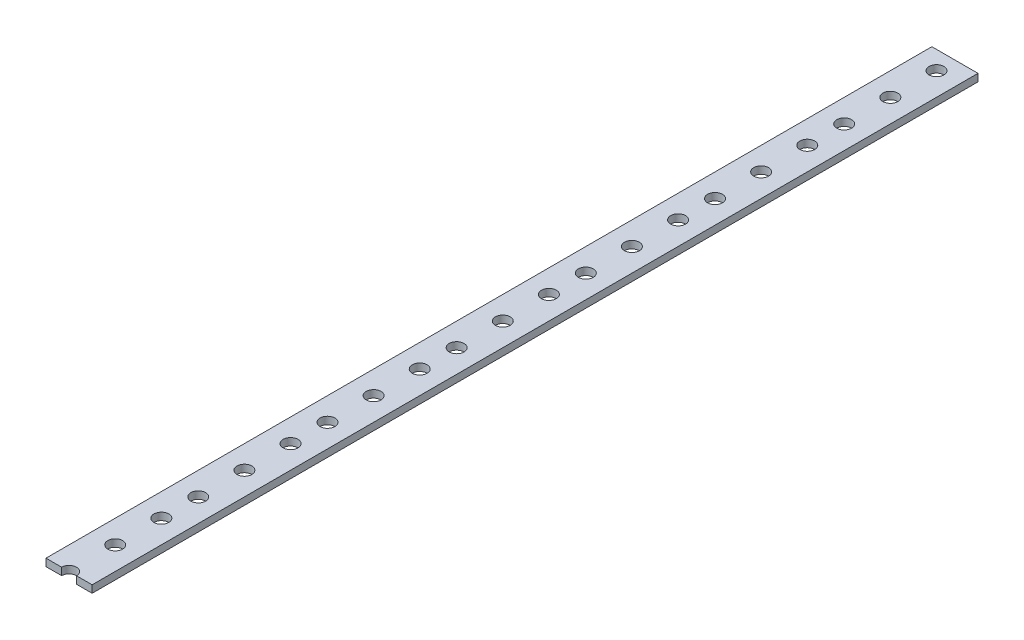
from build123d import *

# Parameters (mm, degrees)
SKETCH1_W                  = 15.875
SKETCH1_H                  = 304.8
BOSS_EXTRUDE1_DEPTH        = 2.54
SKETCH2_R                  = 2.5527
CUT_EXTRUDE1_DEPTH         = 2.54
LPATTERN1_COUNT            = 3
LPATTERN1_PITCH            = 15.875
LPATTERN2_COUNT            = 7
LPATTERN2_PITCH            = 44.45
LPATTERN2_COPY_1_SKETCH_R  = 2.5527
LPATTERN2_COPY_1_DEPTH     = 2.54
LPATTERN2_COPY_2_SKETCH_R  = 2.5527
LPATTERN2_COPY_2_DEPTH     = 2.54
LPATTERN2_COPY_3_SKETCH_R  = 2.5527
LPATTERN2_COPY_3_DEPTH     = 2.54
LPATTERN2_COPY_4_SKETCH_R  = 2.5527
LPATTERN2_COPY_4_DEPTH     = 2.54
LPATTERN2_COPY_5_SKETCH_R  = 2.5527
LPATTERN2_COPY_5_DEPTH     = 2.54
LPATTERN2_COPY_6_SKETCH_R  = 2.5527
LPATTERN2_COPY_6_DEPTH     = 2.54
LPATTERN2_COPY_7_SKETCH_R  = 2.5527
LPATTERN2_COPY_7_DEPTH     = 2.54
LPATTERN2_COPY_8_SKETCH_R  = 2.5527
LPATTERN2_COPY_8_DEPTH     = 2.54
LPATTERN2_COPY_9_SKETCH_R  = 2.5527
LPATTERN2_COPY_9_DEPTH     = 2.54
LPATTERN2_COPY_10_SKETCH_R = 2.5527
LPATTERN2_COPY_10_DEPTH    = 2.54
LPATTERN2_COPY_11_SKETCH_R = 2.5527
LPATTERN2_COPY_11_DEPTH    = 2.54
LPATTERN2_COPY_12_SKETCH_R = 2.5527
LPATTERN2_COPY_12_DEPTH    = 2.54


with BuildPart() as part:
    # Sketch1 → Boss-Extrude1 (new body)
    with BuildSketch(Plane(origin=(0, 0, 0), x_dir=(1, 0, 0), z_dir=(0, 1, 0))):
        Rectangle(SKETCH1_W, SKETCH1_H)
    extrude(amount=BOSS_EXTRUDE1_DEPTH)

    # Sketch2 → Cut-Extrude1 (cut)
    with BuildSketch(Plane(origin=(0, 2.54, 0), x_dir=(1, 0, 0), z_dir=(0, 1, 0))):
        with Locations(Location((0, 146.05, 0), (0, 0, 270))):
            Circle(SKETCH2_R)
    cut_extrude1 = extrude(amount=-CUT_EXTRUDE1_DEPTH, mode=Mode.SUBTRACT)

    # LPattern1: Cut-Extrude1 ×3
    with Locations(*[(0, 0, i * LPATTERN1_PITCH) for i in range(1, LPATTERN1_COUNT)]):
        add(cut_extrude1, mode=Mode.SUBTRACT)

    # LPattern2: Cut-Extrude1 ×7
    with Locations(*[(0, 0, i * LPATTERN2_PITCH) for i in range(1, LPATTERN2_COUNT)]):
        add(cut_extrude1, mode=Mode.SUBTRACT)

    # LPattern2 copy 1 sketch → LPattern2 copy 1 (cut)
    with BuildSketch(Plane(origin=(0, 2.54, 60.325), x_dir=(1, 0, 0), z_dir=(0, 1, 0))):
        with Locations(Location((0, 146.05, 0), (0, 0, 270))):
            Circle(LPATTERN2_COPY_1_SKETCH_R)
    extrude(amount=-LPATTERN2_COPY_1_DEPTH, mode=Mode.SUBTRACT)

    # LPattern2 copy 2 sketch → LPattern2 copy 2 (cut)
    with BuildSketch(Plane(origin=(0, 2.54, 104.775), x_dir=(1, 0, 0), z_dir=(0, 1, 0))):
        with Locations(Location((0, 146.05, 0), (0, 0, 270))):
            Circle(LPATTERN2_COPY_2_SKETCH_R)
    extrude(amount=-LPATTERN2_COPY_2_DEPTH, mode=Mode.SUBTRACT)

    # LPattern2 copy 3 sketch → LPattern2 copy 3 (cut)
    with BuildSketch(Plane(origin=(0, 2.54, 149.225), x_dir=(1, 0, 0), z_dir=(0, 1, 0))):
        with Locations(Location((0, 146.05, 0), (0, 0, 270))):
            Circle(LPATTERN2_COPY_3_SKETCH_R)
    extrude(amount=-LPATTERN2_COPY_3_DEPTH, mode=Mode.SUBTRACT)

    # LPattern2 copy 4 sketch → LPattern2 copy 4 (cut)
    with BuildSketch(Plane(origin=(0, 2.54, 193.675), x_dir=(1, 0, 0), z_dir=(0, 1, 0))):
        with Locations(Location((0, 146.05, 0), (0, 0, 270))):
            Circle(LPATTERN2_COPY_4_SKETCH_R)
    extrude(amount=-LPATTERN2_COPY_4_DEPTH, mode=Mode.SUBTRACT)

    # LPattern2 copy 5 sketch → LPattern2 copy 5 (cut)
    with BuildSketch(Plane(origin=(0, 2.54, 238.125), x_dir=(1, 0, 0), z_dir=(0, 1, 0))):
        with Locations(Location((0, 146.05, 0), (0, 0, 270))):
            Circle(LPATTERN2_COPY_5_SKETCH_R)
    extrude(amount=-LPATTERN2_COPY_5_DEPTH, mode=Mode.SUBTRACT)

    # LPattern2 copy 6 sketch → LPattern2 copy 6 (cut)
    with BuildSketch(Plane(origin=(0, 2.54, 282.575), x_dir=(1, 0, 0), z_dir=(0, 1, 0))):
        with Locations(Location((0, 146.05, 0), (0, 0, 270))):
            Circle(LPATTERN2_COPY_6_SKETCH_R)
    extrude(amount=-LPATTERN2_COPY_6_DEPTH, mode=Mode.SUBTRACT)

    # LPattern2 copy 7 sketch → LPattern2 copy 7 (cut)
    with BuildSketch(Plane(origin=(0, 2.54, 76.2), x_dir=(1, 0, 0), z_dir=(0, 1, 0))):
        with Locations(Location((0, 146.05, 0), (0, 0, 270))):
            Circle(LPATTERN2_COPY_7_SKETCH_R)
    extrude(amount=-LPATTERN2_COPY_7_DEPTH, mode=Mode.SUBTRACT)

    # LPattern2 copy 8 sketch → LPattern2 copy 8 (cut)
    with BuildSketch(Plane(origin=(0, 2.54, 120.65), x_dir=(1, 0, 0), z_dir=(0, 1, 0))):
        with Locations(Location((0, 146.05, 0), (0, 0, 270))):
            Circle(LPATTERN2_COPY_8_SKETCH_R)
    extrude(amount=-LPATTERN2_COPY_8_DEPTH, mode=Mode.SUBTRACT)

    # LPattern2 copy 9 sketch → LPattern2 copy 9 (cut)
    with BuildSketch(Plane(origin=(0, 2.54, 165.1), x_dir=(1, 0, 0), z_dir=(0, 1, 0))):
        with Locations(Location((0, 146.05, 0), (0, 0, 270))):
            Circle(LPATTERN2_COPY_9_SKETCH_R)
    extrude(amount=-LPATTERN2_COPY_9_DEPTH, mode=Mode.SUBTRACT)

    # LPattern2 copy 10 sketch → LPattern2 copy 10 (cut)
    with BuildSketch(Plane(origin=(0, 2.54, 209.55), x_dir=(1, 0, 0), z_dir=(0, 1, 0))):
        with Locations(Location((0, 146.05, 0), (0, 0, 270))):
            Circle(LPATTERN2_COPY_10_SKETCH_R)
    extrude(amount=-LPATTERN2_COPY_10_DEPTH, mode=Mode.SUBTRACT)

    # LPattern2 copy 11 sketch → LPattern2 copy 11 (cut)
    with BuildSketch(Plane(origin=(0, 2.54, 254), x_dir=(1, 0, 0), z_dir=(0, 1, 0))):
        with Locations(Location((0, 146.05, 0), (0, 0, 270))):
            Circle(LPATTERN2_COPY_11_SKETCH_R)
    extrude(amount=-LPATTERN2_COPY_11_DEPTH, mode=Mode.SUBTRACT)

    # LPattern2 copy 12 sketch → LPattern2 copy 12 (cut)
    with BuildSketch(Plane(origin=(0, 2.54, 298.45), x_dir=(1, 0, 0), z_dir=(0, 1, 0))):
        with Locations(Location((0, 146.05, 0), (0, 0, 270))):
            Circle(LPATTERN2_COPY_12_SKETCH_R)
    extrude(amount=-LPATTERN2_COPY_12_DEPTH, mode=Mode.SUBTRACT)


solid = part.part
